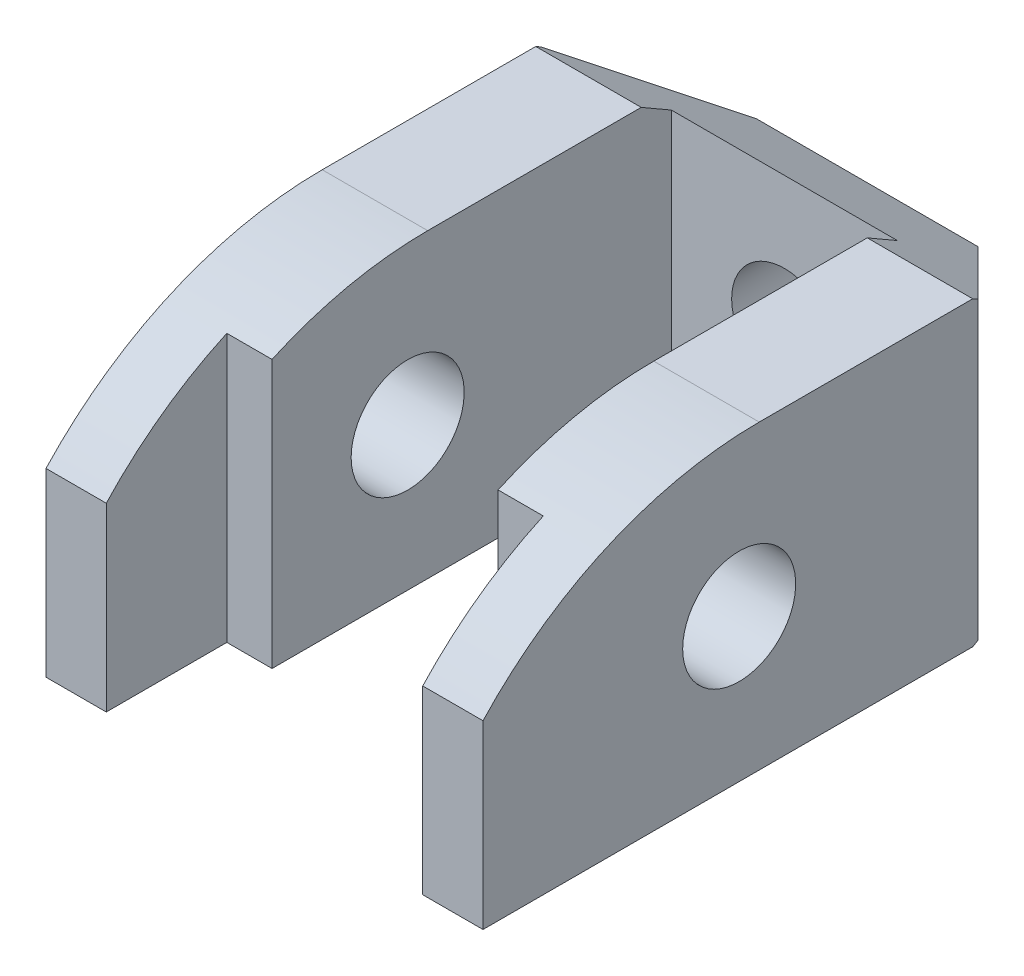
from build123d import *

# Parameters (mm, degrees)
SKETCH1_R                           = 7.5
BOSS_EXTRUDE1_DEPTH                 = 58
CUT_EXTRUDE1_DEPTH                  = 107.60206377
CUT_EXTRUDE1_DEPTH_BACK             = 10
SKETCH3_W                           = 30
SKETCH3_H                           = 53
CUT_EXTRUDE3_DEPTH                  = 107.60206377
CUT_EXTRUDE3_DIRECTION_2_REACH      = 108.602
CUT_EXTRUDE3_DIRECTION_2_END_RADIUS = 50
CUT_EXTRUDE4_DEPTH                  = 107.60206377
SKETCH8_R                           = 7
CUT_EXTRUDE5_DEPTH                  = 107.60206377


with BuildPart() as part:
    # Sketch1 → Boss-Extrude1 (new body)
    with BuildSketch(Plane(origin=(0, 0, 0), x_dir=(0, 0, -1), z_dir=(1, 0, 0))):
        with BuildLine():
            Line((0, 0), (65, 0))
            Line((65, 0), (80, 8.660254038))
            Line((80, 8.660254038), (80, 31.339745962))
            Line((80, 31.339745962), (65, 40))
            Line((65, 40), (36.66060556, 40))
            ThreePointArc((36.66060556, 40), (16.66060556, 35.82575695), (0, 24))
            Line((0, 24), (0, 0))
        make_face()
        with Locations(Location((34, 19, 0), (0, 0, 180))):
            Circle(SKETCH1_R, mode=Mode.SUBTRACT)
    extrude(amount=BOSS_EXTRUDE1_DEPTH)

    # Sketch3 → Cut-Extrude1 (cut, two sides: drawn at the far end of the back side and taken through both)
    with BuildSketch(Plane(origin=(0, 0, 0), x_dir=(1, 0, 0), z_dir=(0, 1, 0)).offset(-CUT_EXTRUDE1_DEPTH_BACK)):
        with Locations((29, 42.5)):
            Rectangle(SKETCH3_W, SKETCH3_H)
    extrude(amount=CUT_EXTRUDE1_DEPTH + CUT_EXTRUDE1_DEPTH_BACK, mode=Mode.SUBTRACT)

    # Sketch5 → Cut-Extrude3 (cut)
    with BuildSketch(Plane(origin=(0, 0, 0), x_dir=(1, 0, 0), z_dir=(0, 1, 0))):
        Polygon((29, 0), (29, 16), (14, 16), (8, 16), (8, 0), align=None)
        Polygon((44, 16), (29, 16), (29, 0), (50, 0), (50, 16), align=None)
    extrude(amount=-CUT_EXTRUDE3_DEPTH, mode=Mode.SUBTRACT)

    # Cut-Extrude3 direction 2: up to this cylinder (the profile starts inside it)
    cut_extrude3_direction_2_end = Plane(origin=(29, -10, -36.66060556), z_dir=(-1, 0, 0)) * Cylinder(CUT_EXTRUDE3_DIRECTION_2_END_RADIUS, 339.204, mode=Mode.PRIVATE)
    # Sketch5 → Cut-Extrude3 direction 2 (cut, up to the surface)
    with BuildSketch(Plane(origin=(0, 0, 0), x_dir=(1, 0, 0), z_dir=(0, 1, 0)), mode=Mode.PRIVATE) as cut_extrude3_direction_2_sk1:
        Polygon((29, 0), (29, 16), (14, 16), (8, 16), (8, 0), align=None)
    cut_extrude3_direction_2_tool1 = extrude(cut_extrude3_direction_2_sk1.sketch, amount=CUT_EXTRUDE3_DIRECTION_2_REACH, mode=Mode.PRIVATE) & cut_extrude3_direction_2_end
    add(cut_extrude3_direction_2_tool1.solids().sort_by_distance((18.5, 0, -8))[0], mode=Mode.SUBTRACT)
    # Sketch5 → Cut-Extrude3 direction 2 (cut, up to the surface)
    with BuildSketch(Plane(origin=(0, 0, 0), x_dir=(1, 0, 0), z_dir=(0, 1, 0)), mode=Mode.PRIVATE) as cut_extrude3_direction_2_sk2:
        Polygon((44, 16), (29, 16), (29, 0), (50, 0), (50, 16), align=None)
    cut_extrude3_direction_2_tool2 = extrude(cut_extrude3_direction_2_sk2.sketch, amount=CUT_EXTRUDE3_DIRECTION_2_REACH, mode=Mode.PRIVATE) & cut_extrude3_direction_2_end
    add(cut_extrude3_direction_2_tool2.solids().sort_by_distance((39.5, 0, -8))[0], mode=Mode.SUBTRACT)

    # Sketch7 → Cut-Extrude4 (cut, through all)
    with BuildSketch(Plane(origin=(0, 0, 0), x_dir=(1, 0, 0), z_dir=(0, 1, 0))):
        Polygon((0, 65.69666313), (14.30333687, 80), (0, 80), align=None)
        Polygon((58, 65.69666313), (43.69666313, 80), (58, 80), align=None)
    extrude(amount=CUT_EXTRUDE4_DEPTH, mode=Mode.SUBTRACT)

    # Sketch8 → Cut-Extrude5 (cut, through all)
    with BuildSketch(Plane(origin=(0, 0, -80), x_dir=(-1, 0, 0), z_dir=(0, 0, -1))):
        with Locations((-29, 20)):
            Circle(SKETCH8_R)
    extrude(amount=-CUT_EXTRUDE5_DEPTH, mode=Mode.SUBTRACT)


solid = part.part
